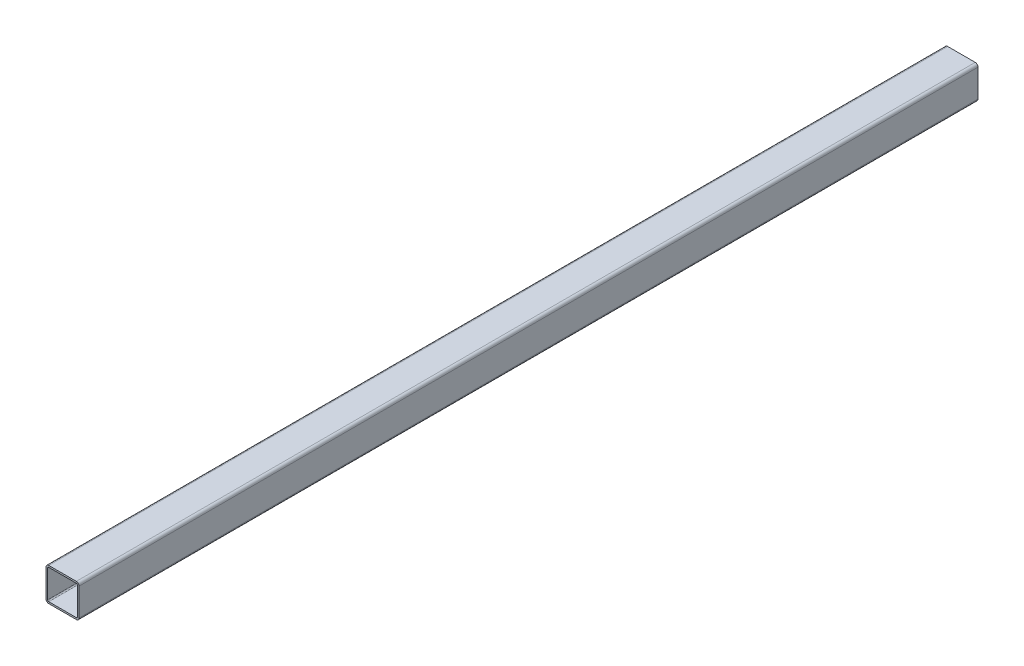
from build123d import *

# Parameters (mm, degrees)
EXTRUDE_1_DEPTH = 815
SHELL_1_T       = -3


with BuildPart() as part:
    # Эскиз1 → Бобышка-Вытянуть1 (new, symmetric)
    with BuildSketch(Plane.XY):
        with BuildLine():
            Line((-25, -30), (25, -30))
            ThreePointArc((25, -30), (28.535533906, -28.535533906), (30, -25))
            Line((30, -25), (30, 25))
            ThreePointArc((30, 25), (28.535533906, 28.535533906), (25, 30))
            Line((25, 30), (-25, 30))
            ThreePointArc((-25, 30), (-28.535533906, 28.535533906), (-30, 25))
            Line((-30, 25), (-30, -25))
            ThreePointArc((-30, -25), (-28.535533906, -28.535533906), (-25, -30))
        make_face()
    extrude(amount=EXTRUDE_1_DEPTH, both=True)

    # Оболочка1
    shell_1_openings = [part.faces().sort_by_distance(p)[0] for p in [
        (0, 0, 815),
        (0, 0, -815),
    ]]
    offset(amount=SHELL_1_T, openings=shell_1_openings, kind=Kind.INTERSECTION)


solid = part.part
